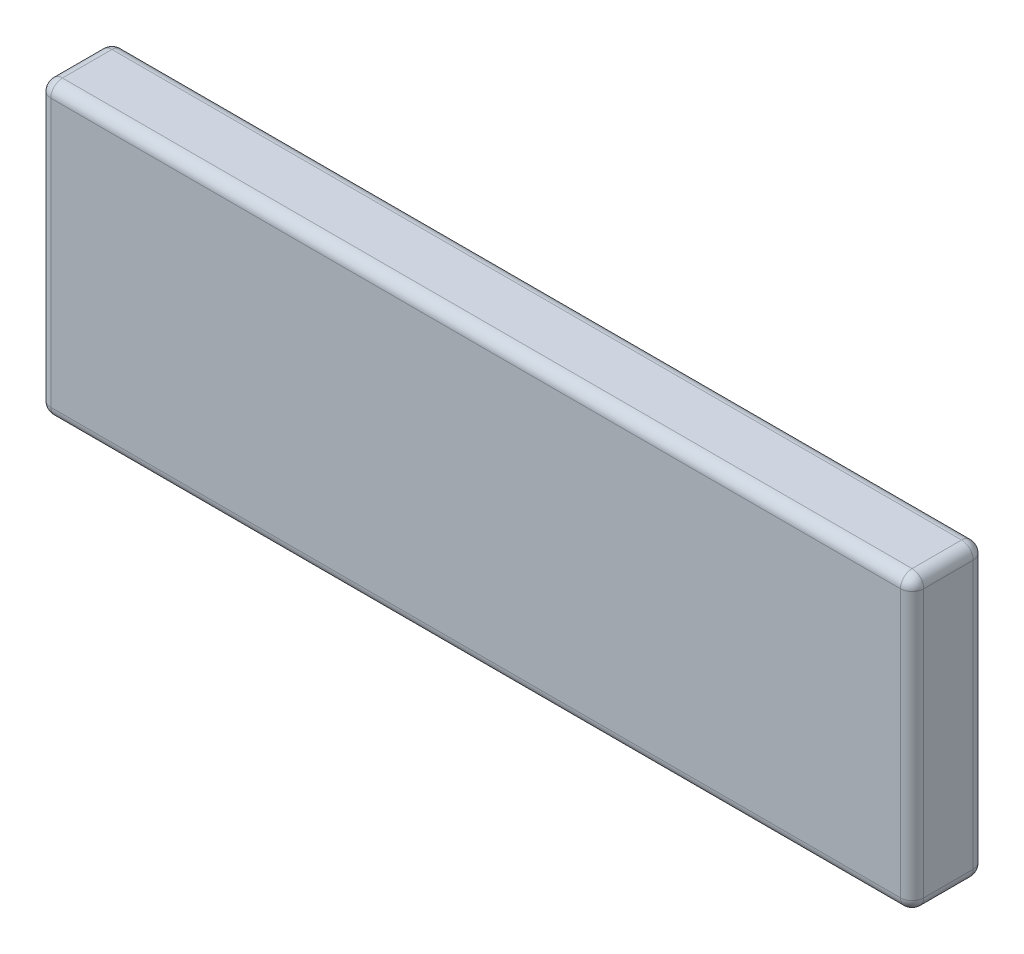
from build123d import *

# Parameters (mm, degrees)
SKETCH1_W           = 19.05
SKETCH1_H           = 6.35
BOSS_EXTRUDE1_DEPTH = 1.5875
FILLET1_R           = 0.254


with BuildPart() as part:
    # Sketch1 → Boss-Extrude1 (new body)
    with BuildSketch(Plane.XY):
        Rectangle(SKETCH1_W, SKETCH1_H)
    extrude(amount=BOSS_EXTRUDE1_DEPTH)

    # Fillet1
    fillet1_edges = [part.edges().sort_by_distance(p)[0] for p in [
        (-9.525, 0, 1.5875),
        (0, -3.175, 1.5875),
        (9.525, 0, 1.5875),
        (0, -3.175, 0),
        (-9.525, 0, 0),
        (0, 3.175, 0),
        (9.525, 0, 0),
        (9.525, -3.175, 0.79375),
        (-9.525, -3.175, 0.79375),
        (-9.525, 3.175, 0.79375),
        (9.525, 3.175, 0.79375),
        (0, 3.175, 1.5875),
    ]]
    fillet(fillet1_edges, radius=FILLET1_R)


solid = part.part
